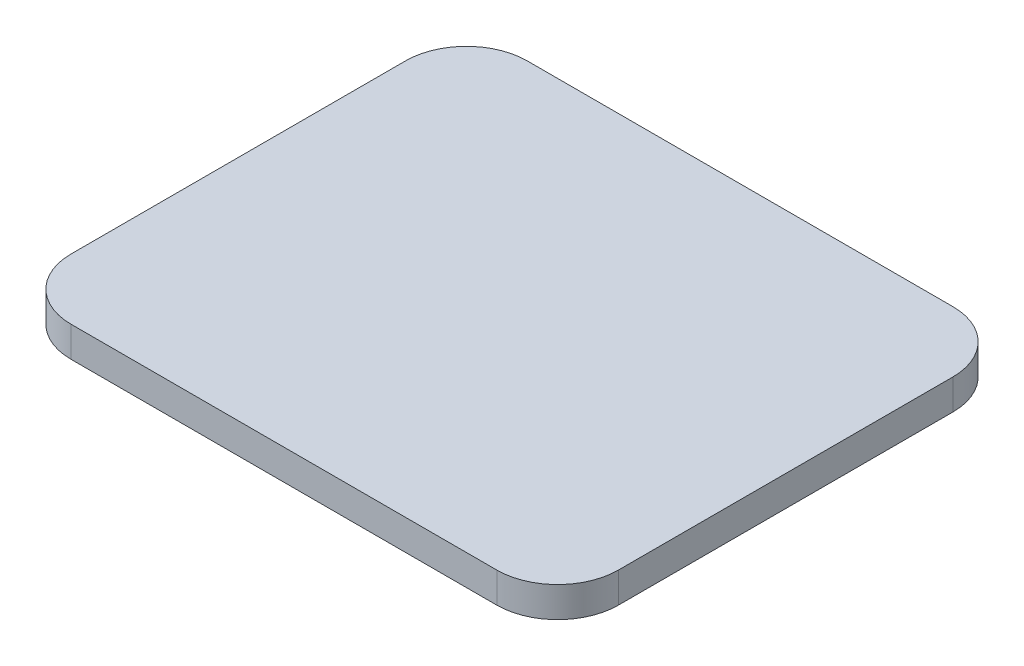
from build123d import *

# Parameters (mm, degrees)
BOSS_EXTRUDE1_DEPTH = 1


with BuildPart() as part:
    # Sketch1 → Boss-Extrude1 (new body)
    with BuildSketch(Plane(origin=(0, 0, 0), x_dir=(1, 0, 0), z_dir=(0, 1, 0))):
        with BuildLine():
            Line((2, 0), (16, 0))
            ThreePointArc((16, 0), (17.414213562, 0.585786438), (18, 2))
            Line((18, 2), (18, 13))
            ThreePointArc((18, 13), (17.414213562, 14.414213562), (16, 15))
            Line((16, 15), (2, 15))
            ThreePointArc((2, 15), (0.585786438, 14.414213562), (0, 13))
            Line((0, 13), (0, 2))
            ThreePointArc((0, 2), (0.585786438, 0.585786438), (2, 0))
        make_face()
    extrude(amount=BOSS_EXTRUDE1_DEPTH)


solid = part.part
